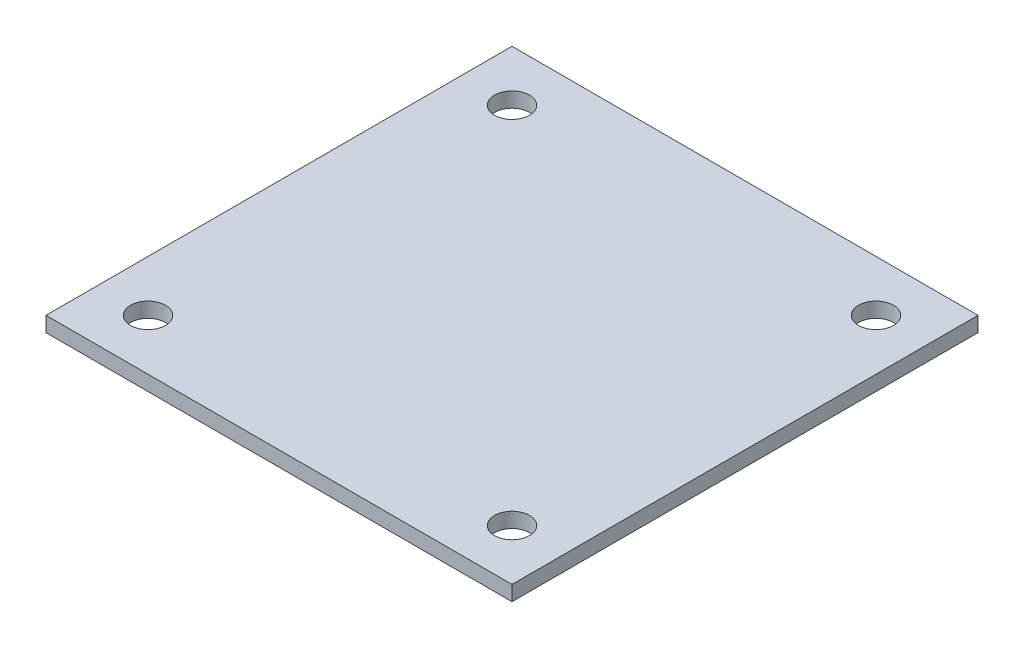
from build123d import *

# Parameters (mm, degrees)
SKETCH1_W           = 46.6
SKETCH1_H           = 46.6
SKETCH1_R           = 1.75
BOSS_EXTRUDE1_DEPTH = 1.5


with BuildPart() as part:
    # Sketch1 → Boss-Extrude1 (new body)
    with BuildSketch(Plane(origin=(0, 0, 0), x_dir=(1, 0, 0), z_dir=(0, 1, 0))):
        Rectangle(SKETCH1_W, SKETCH1_H)
        with Locations(Location((-18.2, 18.2, 0), (0, 0, 270))):
            Circle(SKETCH1_R, mode=Mode.SUBTRACT)
        with Locations(Location((-18.2, -18.2, 0), (0, 0, 270))):
            Circle(SKETCH1_R, mode=Mode.SUBTRACT)
        with Locations(Location((18.2, -18.2, 0), (0, 0, 90))):
            Circle(SKETCH1_R, mode=Mode.SUBTRACT)
        with Locations(Location((18.2, 18.2, 0), (0, 0, 90))):
            Circle(SKETCH1_R, mode=Mode.SUBTRACT)
    extrude(amount=BOSS_EXTRUDE1_DEPTH)


solid = part.part
